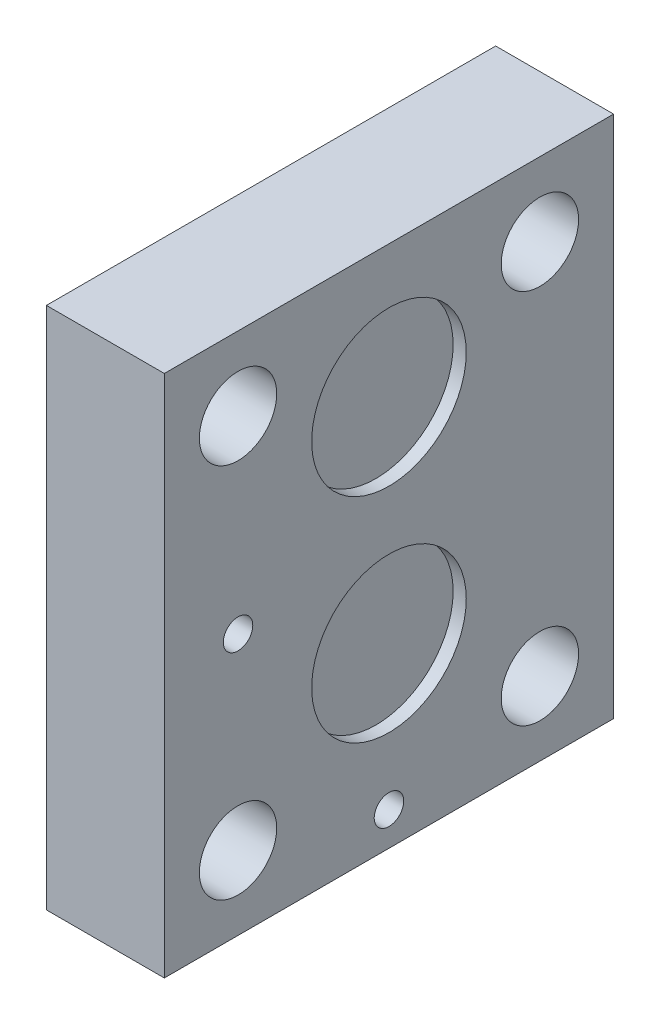
from build123d import *

# Parameters (mm, degrees)
SKETCH1_W           = 112.776
SKETCH1_H           = 96.774
BOSS_EXTRUDE1_DEPTH = 25.4
SKETCH2_R           = 8.334375
CUT_EXTRUDE2_DEPTH  = 151.760715215
SKETCH3_R           = 8.334375
CUT_EXTRUDE4_DEPTH  = 151.760715215
SKETCH4_R           = 3.571875
CUT_EXTRUDE6_DEPTH  = 7.874
SKETCH5_R           = 3.571875
CUT_EXTRUDE8_DEPTH  = 7.874
CUT_EXTRUDE10_START = 25.4
SKETCH6_R           = 3.175
CUT_EXTRUDE10_DEPTH = 7.874
CUT_EXTRUDE12_START = 25.4
SKETCH7_R           = 3.175
CUT_EXTRUDE12_DEPTH = 7.874
CUT_EXTRUDE14_START = 25.4
SKETCH8_R           = 16.6497
CUT_EXTRUDE14_DEPTH = 2.8194
CUT_EXTRUDE15_START = 25.4
SKETCH9_R           = 16.6497
CUT_EXTRUDE15_DEPTH = 2.8194


with BuildPart() as part:
    # Sketch1 → Boss-Extrude1 (new body)
    with BuildSketch(Plane.YZ):
        with Locations((56.388, 48.387)):
            Rectangle(SKETCH1_W, SKETCH1_H)
    extrude(amount=BOSS_EXTRUDE1_DEPTH)

    # Sketch2 → Cut-Extrude2 (cut, through all)
    with BuildSketch(Plane.YZ):
        with Locations(Location((15.875, 15.875, 0), (0, 0, 270))):
            Circle(SKETCH2_R)
    extrude(amount=CUT_EXTRUDE2_DEPTH, mode=Mode.SUBTRACT)

    # Sketch3 → Cut-Extrude4 (cut, through all)
    with BuildSketch(Plane.YZ):
        with Locations(Location((96.901, 15.875, 0), (0, 0, 270))):
            Circle(SKETCH3_R)
        with Locations(Location((15.875, 80.899, 0), (0, 0, 270))):
            Circle(SKETCH3_R)
        with Locations(Location((96.901, 80.899, 0), (0, 0, 270))):
            Circle(SKETCH3_R)
    extrude(amount=CUT_EXTRUDE4_DEPTH, mode=Mode.SUBTRACT)

    # Sketch4 → Cut-Extrude6 (cut)
    with BuildSketch(Plane.YZ):
        with Locations(Location((105.537, 48.387, 0), (0, 0, 270))):
            Circle(SKETCH4_R)
    extrude(amount=CUT_EXTRUDE6_DEPTH, mode=Mode.SUBTRACT)

    # Sketch5 → Cut-Extrude8 (cut)
    with BuildSketch(Plane.YZ):
        with Locations(Location((56.515, 15.875, 0), (0, 0, 270))):
            Circle(SKETCH5_R)
    extrude(amount=CUT_EXTRUDE8_DEPTH, mode=Mode.SUBTRACT)

    # Sketch6 → Cut-Extrude10 (cut)
    with BuildSketch(Plane.YZ.offset(CUT_EXTRUDE10_START)):
        with Locations(Location((7.239, 48.387, 0), (0, 0, 270))):
            Circle(SKETCH6_R)
    extrude(amount=-CUT_EXTRUDE10_DEPTH, mode=Mode.SUBTRACT)

    # Sketch7 → Cut-Extrude12 (cut)
    with BuildSketch(Plane.YZ.offset(CUT_EXTRUDE12_START)):
        with Locations(Location((56.261, 80.899, 0), (0, 0, 270))):
            Circle(SKETCH7_R)
    extrude(amount=-CUT_EXTRUDE12_DEPTH, mode=Mode.SUBTRACT)

    # Sketch8 → Cut-Extrude14 (cut)
    with BuildSketch(Plane.YZ.offset(CUT_EXTRUDE14_START)):
        with Locations(Location((38.227, 48.387, 0), (0, 0, 270))):
            Circle(SKETCH8_R)
    extrude(amount=-CUT_EXTRUDE14_DEPTH, mode=Mode.SUBTRACT)

    # Sketch9 → Cut-Extrude15 (cut)
    with BuildSketch(Plane.YZ.offset(CUT_EXTRUDE15_START)):
        with Locations(Location((84.201, 48.387, 0), (0, 0, 270))):
            Circle(SKETCH9_R)
    extrude(amount=-CUT_EXTRUDE15_DEPTH, mode=Mode.SUBTRACT)


solid = part.part
